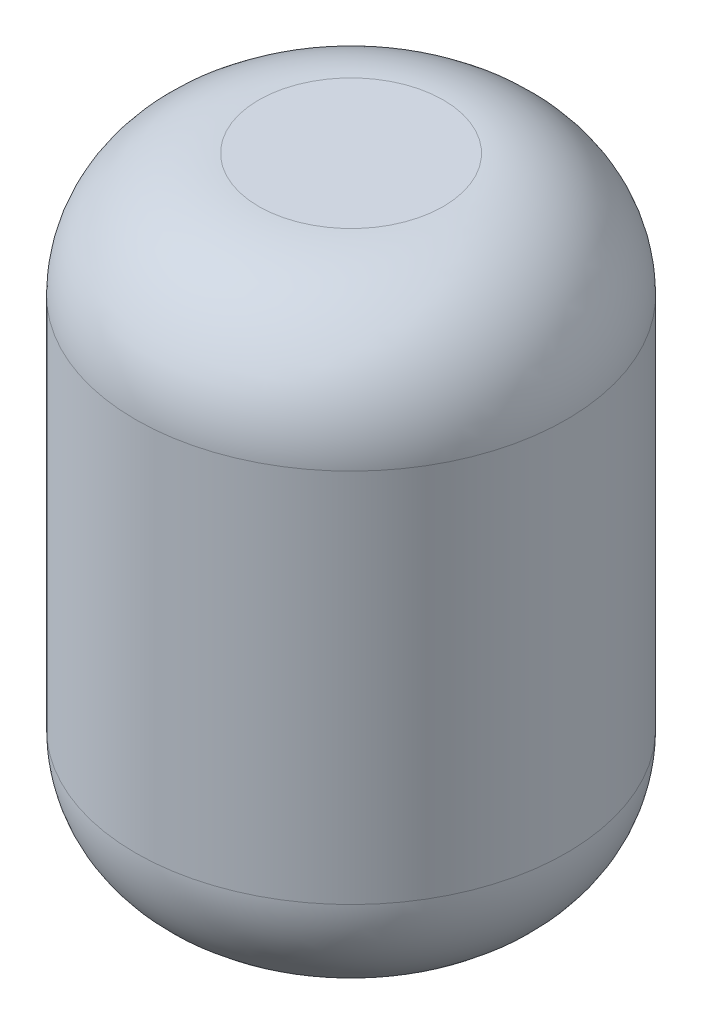
from build123d import *

# Parameters (mm, degrees)
SKETCH1_R           = 70
SKETCH1_R_2         = 68
BOSS_EXTRUDE1_DEPTH = 200
SKETCH2_R           = 70
BOSS_EXTRUDE2_DEPTH = 2
SKETCH4_R           = 70
BOSS_EXTRUDE3_DEPTH = 2
FILLET1_R           = 40


with BuildPart() as part:
    # Sketch1 → Boss-Extrude1 (new body)
    with BuildSketch(Plane(origin=(0, 0, 0), x_dir=(1, 0, 0), z_dir=(0, 1, 0))):
        with Locations(Location((0, 0, 0), (0, 0, 270))):
            Circle(SKETCH1_R)
        with Locations(Location((0, 0, 0), (0, 0, 270))):
            Circle(SKETCH1_R_2, mode=Mode.SUBTRACT)
    extrude(amount=BOSS_EXTRUDE1_DEPTH)

    # Sketch2 → Boss-Extrude2 (add)
    with BuildSketch(Plane.XZ):
        with Locations(Location((0, 0, 0), (0, 0, 90))):
            Circle(SKETCH2_R)
    extrude(amount=-BOSS_EXTRUDE2_DEPTH)

    # Sketch4 → Boss-Extrude3 (add)
    with BuildSketch(Plane(origin=(0, 200, 0), x_dir=(1, 0, 0), z_dir=(0, 1, 0))):
        with Locations(Location((0, 0, 0), (0, 0, 270))):
            Circle(SKETCH4_R)
    extrude(amount=BOSS_EXTRUDE3_DEPTH)

    # Fillet1
    fillet1_edges = [part.edges().sort_by_distance(p)[0] for p in [
        (0, 2, -68),
        (0, 200, -68),
        (0, 202, -70),
        (0, 0, -70),
    ]]
    fillet(fillet1_edges, radius=FILLET1_R)


solid = part.part
